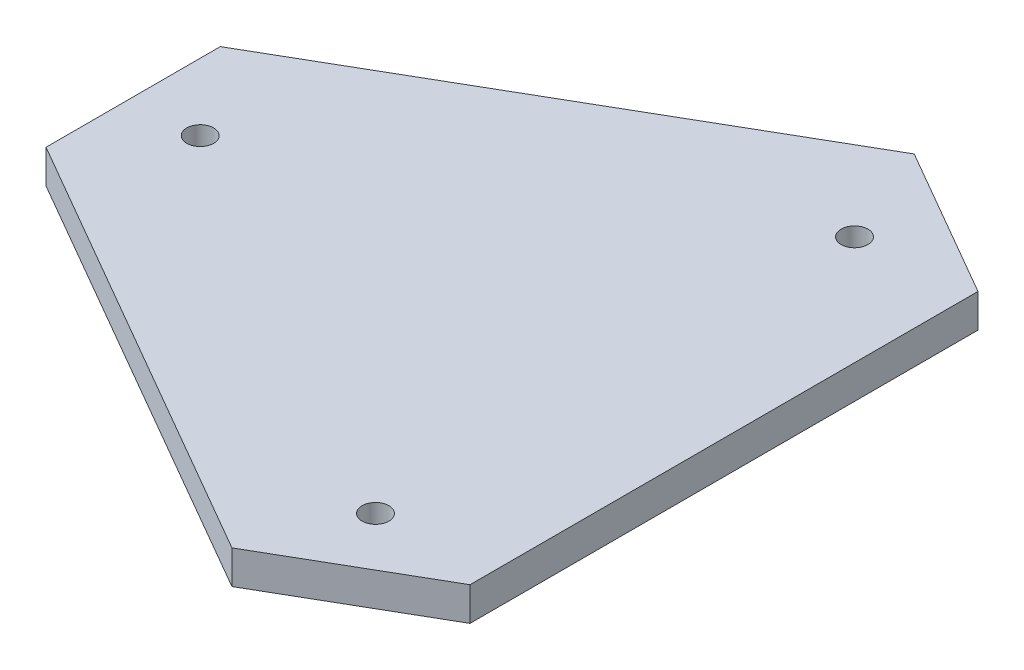
from build123d import *

# Parameters (mm, degrees)
SKETCH16_R          = 2
BOSS_EXTRUDE1_DEPTH = 5


with BuildPart() as part:
    # Sketch16 → Boss-Extrude1 (new body)
    with BuildSketch(Plane(origin=(0, 0, 0), x_dir=(1, 0, 0), z_dir=(0, 1, 0))):
        Polygon((14.367660585, -50.88551812), (-51.251981669, -13), (-51.251981669, 13), (14.367660585, 50.88551812), (36.884321084, 37.88551812), (36.884321084, -37.88551812), align=None)
        with Locations(Location((20.625990835, -35.725264082, 0), (0, 0, 270))):
            Circle(SKETCH16_R, mode=Mode.SUBTRACT)
        with Locations(Location((20.625990835, 35.725264082, 0), (0, 0, 270))):
            Circle(SKETCH16_R, mode=Mode.SUBTRACT)
        with Locations(Location((-41.251981669, 0, 0), (0, 0, 270))):
            Circle(SKETCH16_R, mode=Mode.SUBTRACT)
    extrude(amount=BOSS_EXTRUDE1_DEPTH)


solid = part.part
